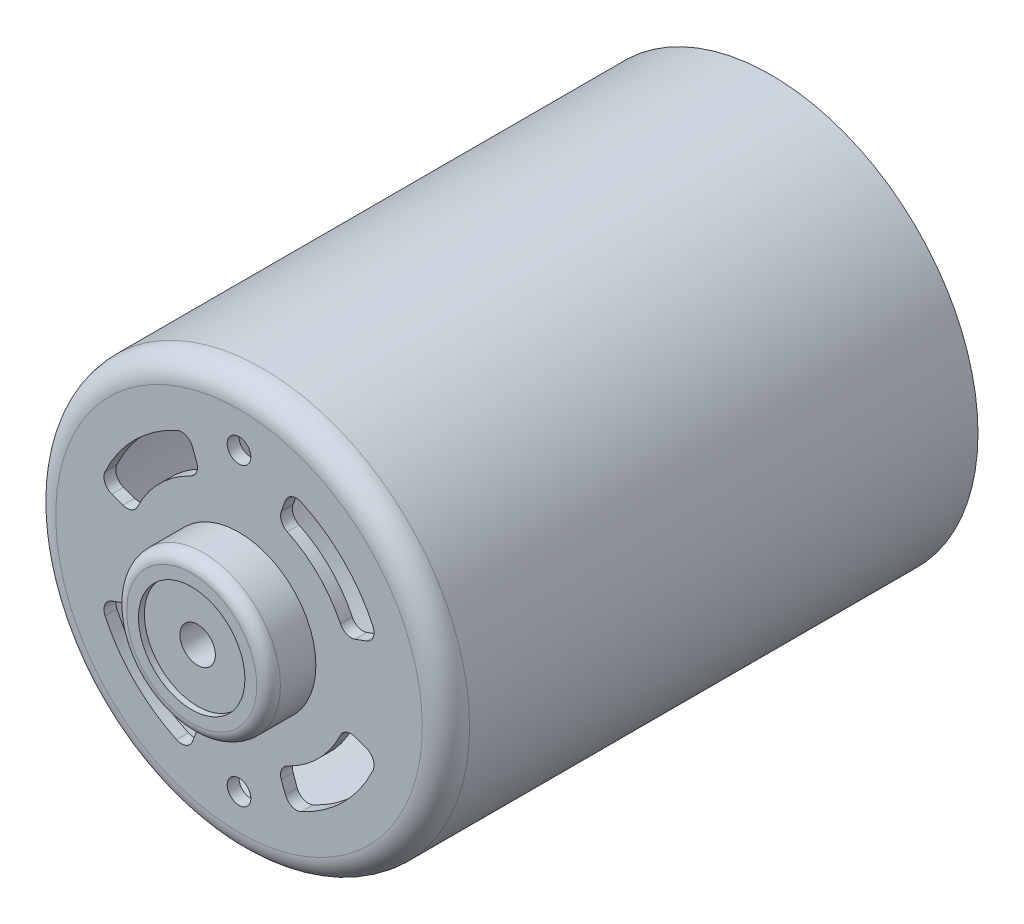
from build123d import *

# Parameters (mm, degrees)
IZIM2_R                     = 17.5
Y_KSEKLIK_EKSTR_ZYON1_DEPTH = 45
IZIM3_R                     = 6.5
Y_KSEKLIK_EKSTR_ZYON2_DEPTH = 4
RADYUS1_R                   = 2
RADYUS2_R                   = 1
IZIM4_R                     = 1
KES_EKSTR_ZYON1_DEPTH       = 45
IZIM5_R                     = 16.5
KES_EKSTR_ZYON2_DEPTH       = 44
RADYUS3_R                   = 1
KES_EKSTR_ZYON3_DEPTH       = 44
DAIRESEL_KAPLAMA1_COUNT     = 4
IZIM9_R                     = 4.5
KES_EKSTR_ZYON4_DEPTH       = 0.5
IZIM10_R                    = 1.5
KES_EKSTR_ZYON6_DEPTH       = 30


with BuildPart() as part:
    # Çizim2 → Yükseklik-Ekstrüzyon1 (new body)
    with BuildSketch(Plane.XY):
        with Locations(Location((0, 0, 0), (0, 0, 180))):
            Circle(IZIM2_R)
    extrude(amount=Y_KSEKLIK_EKSTR_ZYON1_DEPTH)

    # Çizim3 → Yükseklik-Ekstrüzyon2 (add)
    with BuildSketch(Plane.XY.offset(45)):
        Circle(IZIM3_R)
    extrude(amount=Y_KSEKLIK_EKSTR_ZYON2_DEPTH)

    # Radyus1
    radyus1_edges = [part.edges().sort_by_distance(p)[0] for p in [
        (17.5, 0, 45),
    ]]
    fillet(radyus1_edges, radius=RADYUS1_R)

    # Radyus2
    radyus2_edges = [part.edges().sort_by_distance(p)[0] for p in [
        (-6.5, 0, 49),
    ]]
    fillet(radyus2_edges, radius=RADYUS2_R)

    # Çizim4 → Kes-Ekstrüzyon1 (cut)
    with BuildSketch(Plane.XY.offset(45)):
        with Locations((0, 12.5)):
            Circle(IZIM4_R)
    kes_ekstr_zyon1 = extrude(amount=-KES_EKSTR_ZYON1_DEPTH, mode=Mode.SUBTRACT)

    # Çizim5 → Kes-Ekstrüzyon2 (cut)
    with BuildSketch(Plane(origin=(0, 0, 0), x_dir=(-1, 0, 0), z_dir=(0, 0, -1))):
        Circle(IZIM5_R)
    extrude(amount=-KES_EKSTR_ZYON2_DEPTH, mode=Mode.SUBTRACT)

    # Radyus3
    radyus3_edges = [part.edges().sort_by_distance(p)[0] for p in [
        (16.5, 0, 44),
    ]]
    fillet(radyus3_edges, radius=RADYUS3_R)

    # Aynalama1: Kes-Ekstrüzyon1 across plane
    add(kes_ekstr_zyon1.mirror(Plane.ZX), mode=Mode.SUBTRACT)

    # Çizim7 → Kes-Ekstrüzyon3 (cut)
    with BuildSketch(Plane.XY.offset(45)):
        with BuildLine():
            ThreePointArc((8.577055255, 4.084620319), (9.100972079, 3.589155465), (9.82192332, 3.574887732))
            Line((9.82192332, 3.574887732), (10.765531412, 3.91833299))
            ThreePointArc((10.765531412, 3.91833299), (11.347352532, 4.475249801), (11.329903553, 5.28046262))
            ThreePointArc((11.329903553, 5.28046262), (8.838834765, 8.838834765), (5.28046262, 11.329903553))
            ThreePointArc((5.28046262, 11.329903553), (4.475249801, 11.347352532), (3.91833299, 10.765531412))
            Line((3.91833299, 10.765531412), (3.574887732, 9.82192332))
            ThreePointArc((3.574887732, 9.82192332), (3.589155465, 9.100972079), (4.084620319, 8.577055255))
            ThreePointArc((4.084620319, 8.577055255), (6.717514421, 6.717514421), (8.577055255, 4.084620319))
        make_face()
    kes_ekstr_zyon3 = extrude(amount=-KES_EKSTR_ZYON3_DEPTH, mode=Mode.SUBTRACT)

    # Dairesel Kaplama1: Kes-Ekstrüzyon3 ×4 about axis
    dairesel_kaplama1_axis = Axis((0, 0, 0), (0, 0, 1))
    for i in range(1, DAIRESEL_KAPLAMA1_COUNT):
        add(kes_ekstr_zyon3.rotate(dairesel_kaplama1_axis, i * 360 / DAIRESEL_KAPLAMA1_COUNT), mode=Mode.SUBTRACT)

    # Çizim9 → Kes-Ekstrüzyon4 (cut)
    with BuildSketch(Plane.XY.offset(49)):
        Circle(IZIM9_R)
    extrude(amount=-KES_EKSTR_ZYON4_DEPTH, mode=Mode.SUBTRACT)

    # Çizim10 → Kes-Ekstrüzyon6 (cut)
    with BuildSketch(Plane.XY.offset(48.5)):
        Circle(IZIM10_R)
    extrude(amount=-KES_EKSTR_ZYON6_DEPTH, mode=Mode.SUBTRACT)


solid = part.part
